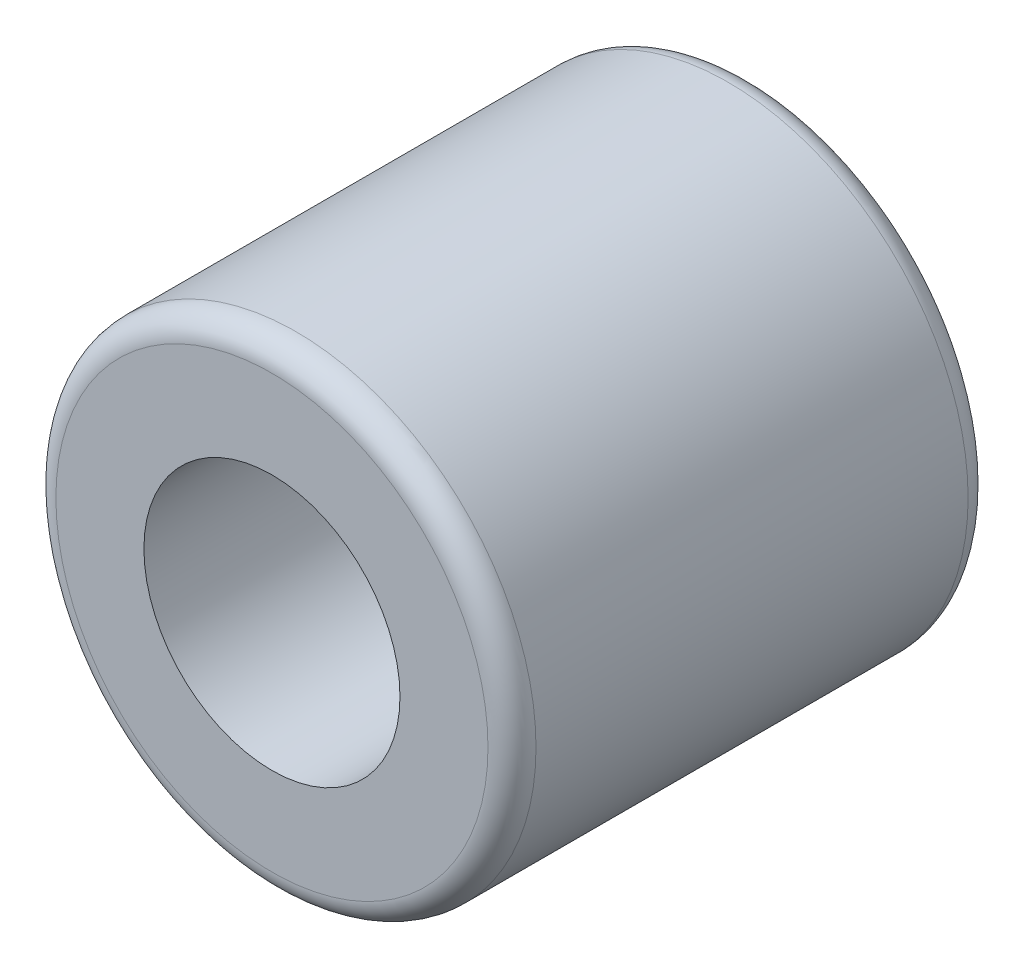
from build123d import *

# Parameters (mm, degrees)
SKETCH1_R           = 3
SKETCH1_R_2         = 1.6
BOSS_EXTRUDE1_DEPTH = 6
FILLET1_R           = 0.3


with BuildPart() as part:
    # Sketch1 → Boss-Extrude1 (new body)
    with BuildSketch(Plane.XY):
        Circle(SKETCH1_R)
        Circle(SKETCH1_R_2, mode=Mode.SUBTRACT)
    extrude(amount=BOSS_EXTRUDE1_DEPTH)

    # Fillet1
    fillet1_edges = [part.edges().sort_by_distance(p)[0] for p in [
        (-3, 0, 0),
        (-3, 0, 6),
    ]]
    fillet(fillet1_edges, radius=FILLET1_R)


solid = part.part
